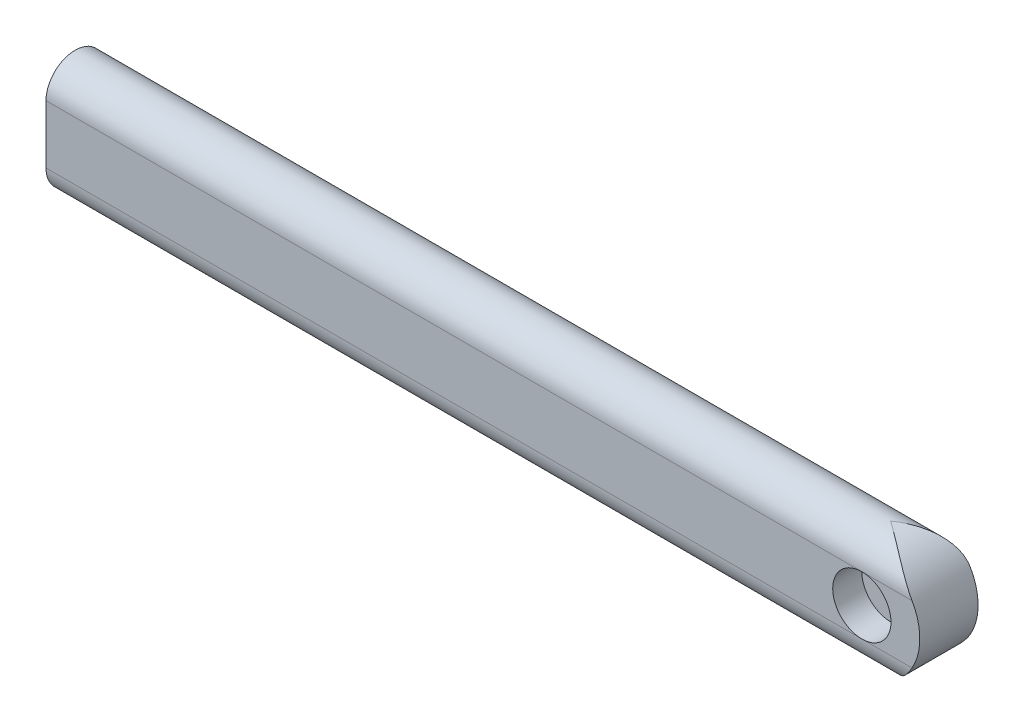
from build123d import *

# Parameters (mm, degrees)
BOSS_EXTRUDE1_DEPTH = 1500
CUT_EXTRUDE1_DEPTH  = 100
SKETCH3_R           = 50
CUT_EXTRUDE2_DEPTH  = 50
SKETCH4_R           = 25
CUT_EXTRUDE3_DEPTH  = 25


with BuildPart() as part:
    # Sketch1 → Boss-Extrude1 (new body)
    with BuildSketch(Plane(origin=(0, 0, 0), x_dir=(0, 0, -1), z_dir=(1, 0, 0))):
        with BuildLine():
            Line((-50, 50), (-50, -50))
            ThreePointArc((-50, -50), (0, -100), (50, -50))
            Line((50, -50), (50, 50))
            ThreePointArc((50, 50), (0, 100), (-50, 50))
        make_face()
    extrude(amount=-BOSS_EXTRUDE1_DEPTH)

    # Sketch2 → Cut-Extrude1 (cut)
    with BuildSketch(Plane.XY.offset(50)):
        with BuildLine():
            Line((-100.5, 100), (0, 100))
            Line((0, 100), (0, -100))
            Line((0, -100), (-100.5, -100))
            ThreePointArc((-100.5, -100), (-0.5, 0), (-100.5, 100))
        make_face()
    extrude(amount=-CUT_EXTRUDE1_DEPTH, mode=Mode.SUBTRACT)

    # Sketch3 → Cut-Extrude2 (cut)
    with BuildSketch(Plane.XY.offset(50)):
        with Locations((-100, 0)):
            Circle(SKETCH3_R)
    extrude(amount=-CUT_EXTRUDE2_DEPTH, mode=Mode.SUBTRACT)

    # Sketch4 → Cut-Extrude3 (cut)
    with BuildSketch(Plane.ZY.offset(1500)):
        with Locations((0, 50)):
            Circle(SKETCH4_R)
        with Locations((0, -50)):
            Circle(SKETCH4_R)
    extrude(amount=-CUT_EXTRUDE3_DEPTH, mode=Mode.SUBTRACT)


solid = part.part
